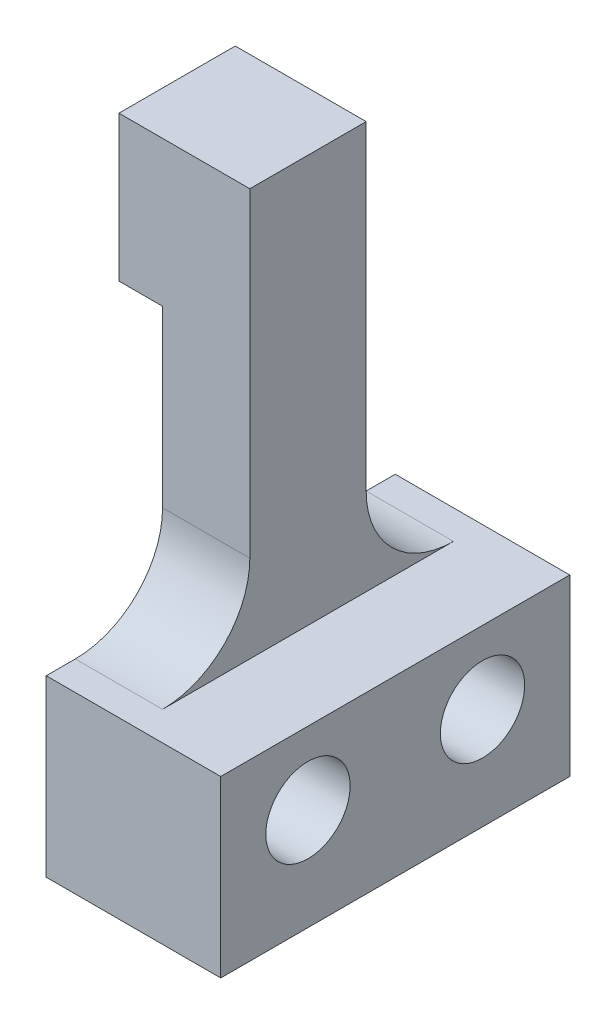
from build123d import *

# Parameters (mm, degrees)
BOSS_EXTRUDE1_DEPTH    = 12
SKETCH2_W              = 4.936858862
SKETCH2_H              = 15.079572613
SKETCH2_W_2            = 5.292899171
CUT_EXTRUDE1_DEPTH     = 19.349069885
FILLET1_R              = 3
M2_5_CLEARANCE_HOLE1_D = 2.9


with BuildPart() as part:
    # Sketch1 → Boss-Extrude1 (new body)
    with BuildSketch(Plane.XY):
        Polygon((0, -6.868421053), (-6, -6.868421053), (-6, 8.131578947), (-7.5, 8.131578947), (-7.5, 13.131578947), (-3, 13.131578947), (-3, -0.868421053), (0, -0.868421053), align=None)
    extrude(amount=BOSS_EXTRUDE1_DEPTH)

    # Sketch2 → Cut-Extrude1 (cut, through all)
    with BuildSketch(Plane(origin=(-3, 0, 0), x_dir=(0, 0, -1), z_dir=(1, 0, 0))):
        with Locations((-10.468429431, 6.671365254)):
            Rectangle(SKETCH2_W, SKETCH2_H)
        with Locations((-1.353550414, 6.671365254)):
            Rectangle(SKETCH2_W_2, SKETCH2_H)
    extrude(amount=-CUT_EXTRUDE1_DEPTH, mode=Mode.SUBTRACT)

    # Fillet1
    fillet1_edges = [part.edges().sort_by_distance(p)[0] for p in [
        (-4.5, -0.868421053, 8),
        (-4.5, -0.868421053, 4),
    ]]
    fillet(fillet1_edges, radius=FILLET1_R)

    # M2.5 Clearance Hole1 (through all)
    with Locations(Plane.ZY.offset(6)):
        with Locations((3, -3.368421053), (9, -3.368421053)):
            Hole(M2_5_CLEARANCE_HOLE1_D / 2)


solid = part.part
